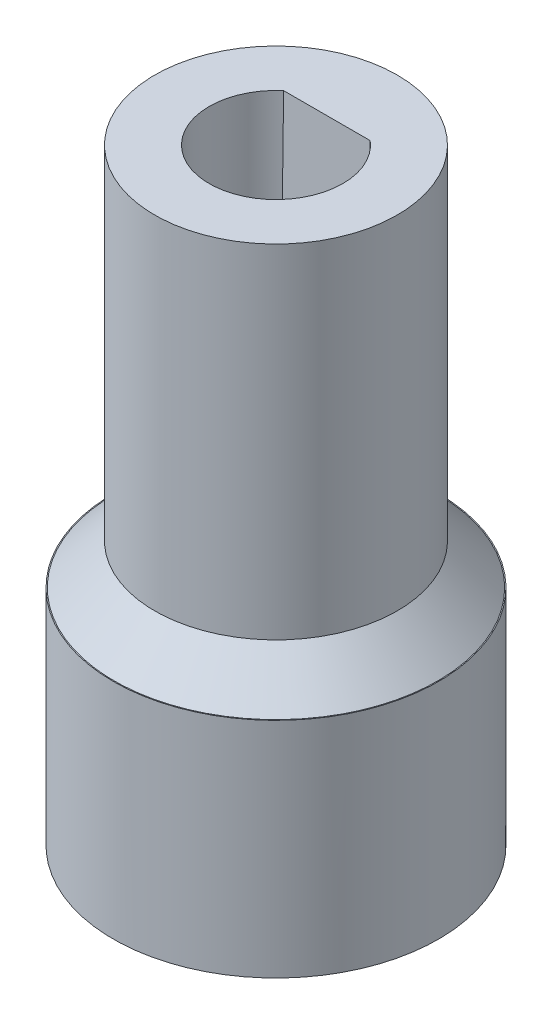
from build123d import *

# Parameters (mm, degrees)
SKETCH1_R           = 7.62
BOSS_EXTRUDE1_DEPTH = 38.1
SKETCH5_R           = 6.096
SKETCH3_R           = 6.450000054
SKETCH6_R           = 10.218046867
SKETCH6_R_2         = 7.62
BOSS_EXTRUDE2_DEPTH = 14.0199999
CHAMFER1_SIZE       = 2.54


with BuildPart() as part:
    # Sketch1 → Boss-Extrude1 (new body)
    with BuildSketch(Plane(origin=(0, 0, 0), x_dir=(1, 0, 0), z_dir=(0, 1, 0))):
        with Locations(Location((0, 0, 0), (0, 0, 90))):
            Circle(SKETCH1_R)
    extrude(amount=BOSS_EXTRUDE1_DEPTH)

    # Sketch4 → Motor Shaft Couple section 0
    with BuildSketch(Plane(origin=(0, 19.0999999, 0), x_dir=(1, 0, 0), z_dir=(0, 1, 0))):
        with BuildLine():
            Line((-2.569046516, 2.8), (2.569046516, 2.8))
            ThreePointArc((2.569046516, 2.8), (0, -3.8), (-2.569046516, 2.8))
        make_face()
    # Sketch2 → Motor Shaft Couple section 1
    with BuildSketch(Plane(origin=(0, 38.1, 0), x_dir=(1, 0, 0), z_dir=(0, 1, 0))):
        with BuildLine():
            Line((-2.720293955, 3.1999996), (2.720293955, 3.1999996))
            ThreePointArc((2.720293955, 3.1999996), (0, -4.1999996), (-2.720293955, 3.1999996))
        make_face()
    loft(mode=Mode.SUBTRACT)

    # Sketch5 → Dowel Couple section 0
    with BuildSketch(Plane(origin=(0, 14.0199999, 0), x_dir=(1, 0, 0), z_dir=(0, 1, 0))):
        Circle(SKETCH5_R)
    # Sketch3 → Dowel Couple section 1
    with BuildSketch(Plane.XZ):
        Circle(SKETCH3_R)
    loft(mode=Mode.SUBTRACT)

    # Sketch6 → Boss-Extrude2 (add)
    with BuildSketch(Plane.XZ):
        with Locations(Location((0, 0, 0), (0, 0, 270))):
            Circle(SKETCH6_R)
        with Locations(Location((0, 0, 0), (0, 0, 270))):
            Circle(SKETCH6_R_2, mode=Mode.SUBTRACT)
    extrude(amount=-BOSS_EXTRUDE2_DEPTH)

    # Chamfer1
    chamfer1_edges = [part.edges().sort_by_distance(p)[0] for p in [
        (0, 14.0199999, 7.62),
    ]]
    chamfer(chamfer1_edges, length=CHAMFER1_SIZE)


solid = part.part
